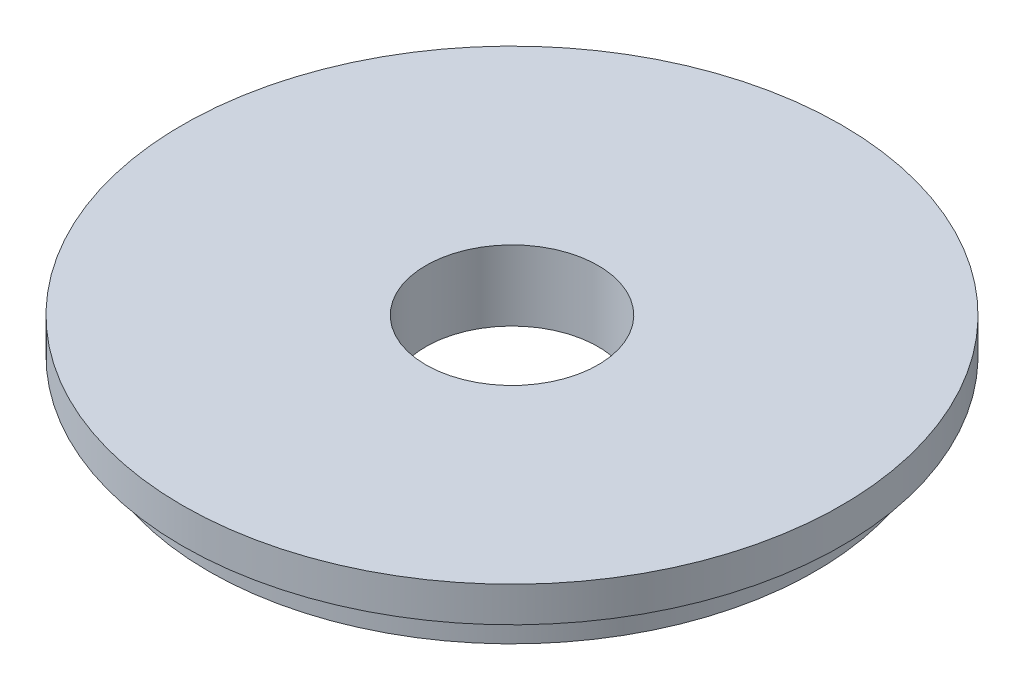
from build123d import *


with BuildPart() as part:
    # Sketch1 → Revolve1 (revolve)
    with BuildSketch(Plane(origin=(0, 0, 0), x_dir=(0, 0, -1), z_dir=(1, 0, 0)), mode=Mode.PRIVATE) as revolve1_sk:
        Polygon((2.4892, -2.032), (2.4892, 0), (9.525, 0), (9.525, -1.016), (8.763, -1.016), (8.763, -2.032), align=None)
    revolve(revolve1_sk.sketch.rotate(Axis((0, 6.621927555, 0), (0, -1, 0)), 180), axis=Axis((0, 6.621927555, 0), (0, -1, 0)))


solid = part.part
